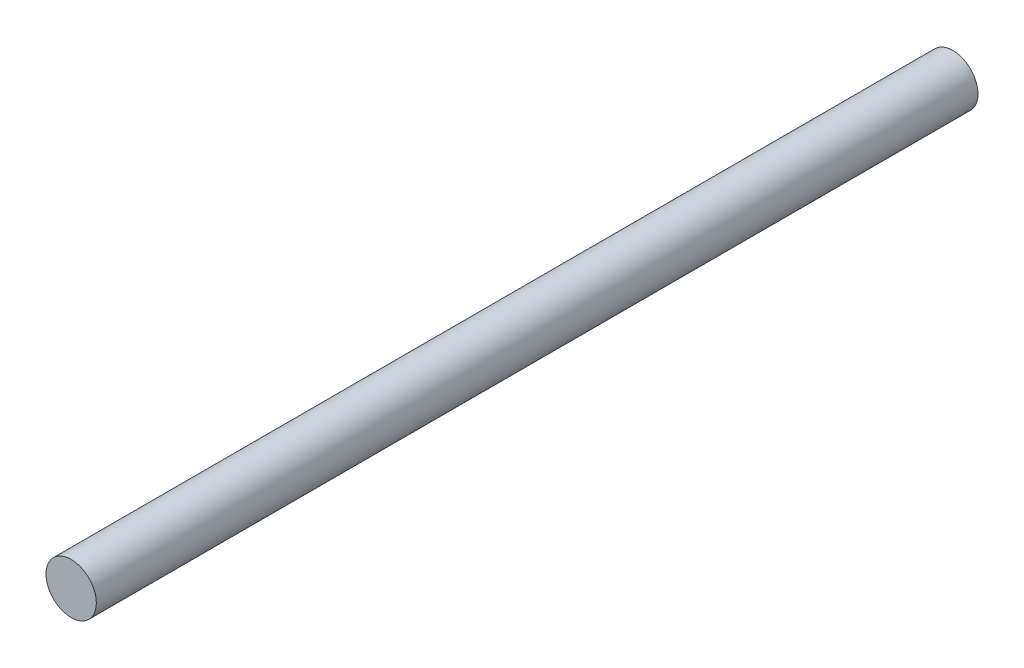
from build123d import *

# Parameters (mm, degrees)
SKETCH1_R           = 4
BOSS_EXTRUDE1_DEPTH = 140


with BuildPart() as part:
    # Sketch1 → Boss-Extrude1 (new body)
    with BuildSketch(Plane.XY):
        Circle(SKETCH1_R)
    extrude(amount=BOSS_EXTRUDE1_DEPTH)


solid = part.part
